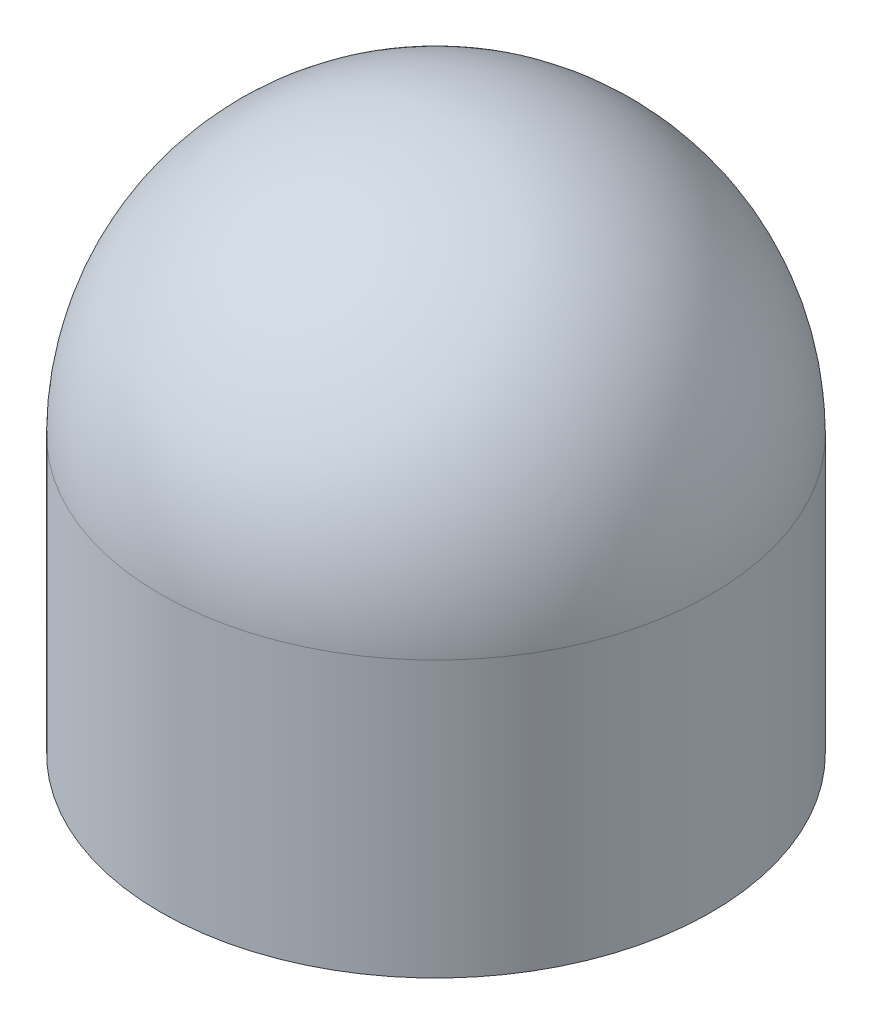
from build123d import *

# Parameters (mm, degrees)
SKETCH_1_R         = 0.125
EXTRUDE_1_DEPTH    = 0.125
DOME_1_FACE_RADIUS = 0.125
DOME_1_HEIGHT      = 0.125


with BuildPart() as part:
    # 草图1 → 凸台-拉伸1 (new body)
    with BuildSketch(Plane(origin=(0, 0, 0), x_dir=(1, 0, 0), z_dir=(0, 1, 0))):
        with Locations(Location((0, 0, 0), (0, 0, 270))):
            Circle(SKETCH_1_R)
    extrude(amount=EXTRUDE_1_DEPTH)

    # 圆顶1: a dome of height H over a round flat face of radius A is a cap of a sphere of radius (A * A + H * H) / (2 * H)
    dome_1_r = (DOME_1_FACE_RADIUS * DOME_1_FACE_RADIUS + DOME_1_HEIGHT * DOME_1_HEIGHT) / (2 * DOME_1_HEIGHT)
    dome_1_base = Plane((0, 0.125, 0), z_dir=(0, 1, 0))
    with Locations(dome_1_base.offset(DOME_1_HEIGHT - dome_1_r)):
        dome_1_ball = Sphere(dome_1_r, mode=Mode.PRIVATE)
    add(split(dome_1_ball, bisect_by=dome_1_base, keep=Keep.TOP, mode=Mode.PRIVATE))


solid = part.part
